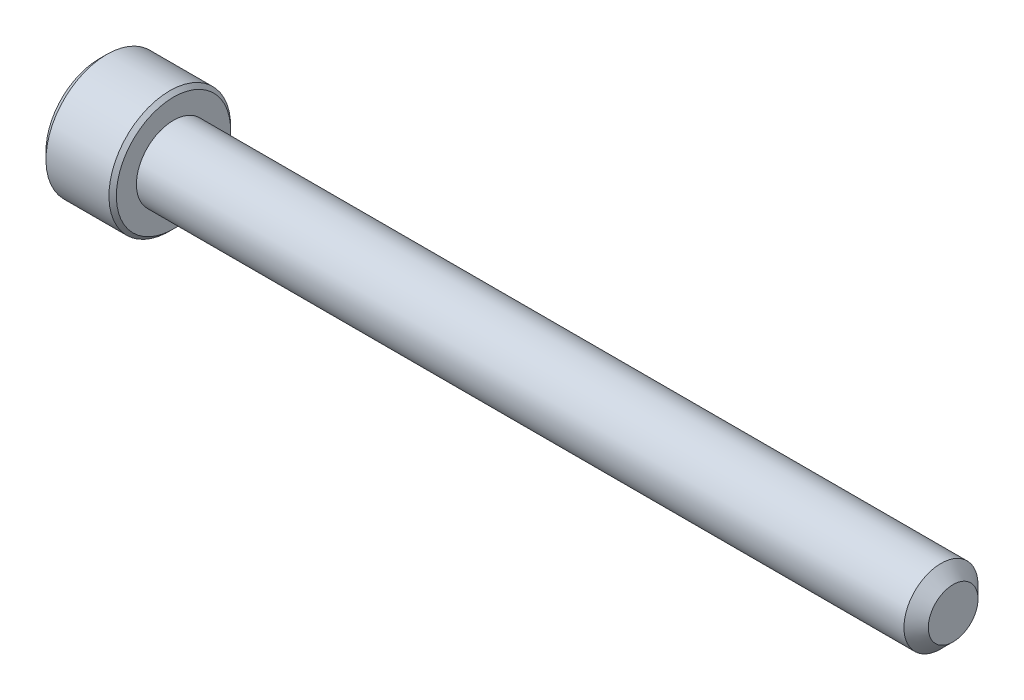
from build123d import *

# Parameters (mm, degrees)
SKETCH2_R           = 2.413
BOSS_EXTRUDE1_DEPTH = 50.8
CHAMFER1_SIZE       = 0.79375
CUT_EXTRUDE1_DEPTH  = 2.286
SKETCH8_R           = 2.287692707
CUT_EXTRUDE2_DEPTH  = 0.9652
CUT_EXTRUDE2_DRAFT  = -45


with BuildPart() as part:
    # Sketch2 → Boss-Extrude1 (new body)
    with BuildSketch(Plane(origin=(25.4, 0, 0), x_dir=(0, 0, -1), z_dir=(1, 0, 0))):
        Circle(SKETCH2_R)
    extrude(amount=-BOSS_EXTRUDE1_DEPTH)

    # Chamfer1
    chamfer1_edges = [part.edges().sort_by_distance(p)[0] for p in [
        (25.4, 0, 2.413),
    ]]
    chamfer(chamfer1_edges, length=CHAMFER1_SIZE)

    # Sketch6 → Revolve1 (revolve)
    with BuildSketch(Plane.XY):
        Polygon((-29.7434, 3.9624), (-30.226, 3.4798), (-30.226, 0), (-25.4, 0), (-25.4, 3.7211), (-25.6413, 3.9624), align=None)
    revolve(axis=Axis((-25.4, 0, 0), (-1, 0, 0)))

    # Sketch4 → Cut-Extrude1 (cut)
    with BuildSketch(Plane(origin=(-30.226, 0, 0), x_dir=(0, 0, -1), z_dir=(1, 0, 0))):
        Polygon((0, 2.287692707), (-1.9812, 1.143846353), (-1.9812, -1.143846353), (0, -2.287692707), (1.9812, -1.143846353), (1.9812, 1.143846353), align=None)
    extrude(amount=CUT_EXTRUDE1_DEPTH, mode=Mode.SUBTRACT)


with BuildPart() as cut_extrude2_tool:
    # Sketch8 → Cut-Extrude2 (with draft: the straight prism first)
    with BuildSketch(Plane.ZY.offset(30.226)):
        Circle(SKETCH8_R)
    extrude(amount=-CUT_EXTRUDE2_DEPTH)
    # Cut-Extrude2: the draft: its side faces are tilted about the plane it starts from
    cut_extrude2_sides = [cut_extrude2_tool.faces().sort_by_distance(p)[0] for p in [
        (-29.7434, 0, -2.287692707),
    ]]
    draft(cut_extrude2_sides, Plane.ZY.offset(30.226), CUT_EXTRUDE2_DRAFT)


with BuildPart() as part_1:
    add(part.part)

    # Cut-Extrude2: cut by cut_extrude2_tool
    add(cut_extrude2_tool.part, mode=Mode.SUBTRACT)


solid = part_1.part
